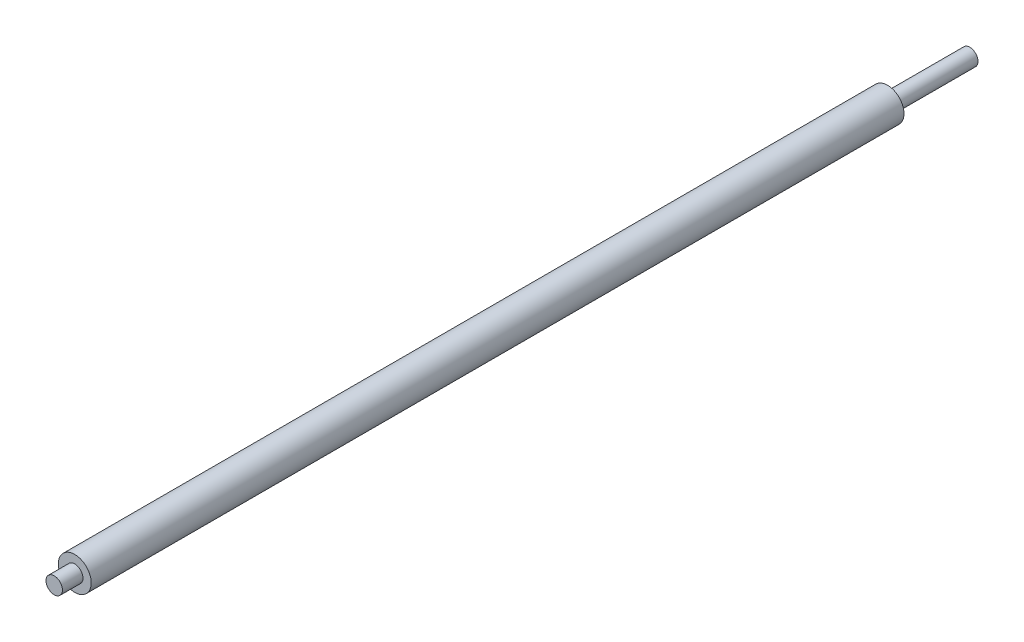
from build123d import *

# Parameters (mm, degrees)
SKETCH1_R           = 6
BOSS_EXTRUDE1_DEPTH = 148.25
SKETCH2_R           = 3
BOSS_EXTRUDE2_DEPTH = 7.5
BOSS_EXTRUDE3_START = 30
SKETCH3_R           = 3
BOSS_EXTRUDE3_DEPTH = 30


with BuildPart() as part:
    # Sketch1 → Boss-Extrude1 (new, symmetric)
    with BuildSketch(Plane.XY):
        Circle(SKETCH1_R)
    extrude(amount=BOSS_EXTRUDE1_DEPTH, both=True)

    # Sketch2 → Boss-Extrude2 (add)
    with BuildSketch(Plane.XY.offset(148.25)):
        Circle(SKETCH2_R)
    extrude(amount=BOSS_EXTRUDE2_DEPTH)

    # Sketch3 → Boss-Extrude3 (add)
    with BuildSketch(Plane(origin=(0, 0, -148.25), x_dir=(-1, 0, 0), z_dir=(0, 0, -1)).offset(BOSS_EXTRUDE3_START)):
        with Locations(Location((0, 0, 0), (0, 0, 180))):
            Circle(SKETCH3_R)
    extrude(amount=-BOSS_EXTRUDE3_DEPTH)


solid = part.part
